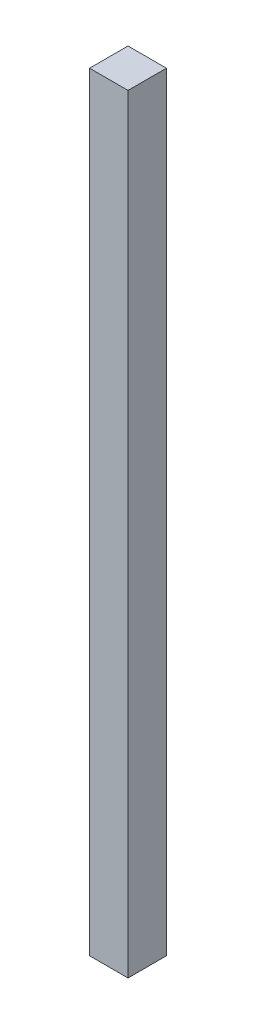
from build123d import *

# Parameters (mm, degrees)
SKIZZE2_W                       = 20
SKIZZE2_H                       = 20
AUFSATZ_LINEAR_AUSTRAGEN1_DEPTH = 400


with BuildPart() as part:
    # Skizze2 → Aufsatz-Linear austragen1 (new body)
    with BuildSketch(Plane(origin=(0, 0, 0), x_dir=(1, 0, 0), z_dir=(0, 1, 0))):
        Rectangle(SKIZZE2_W, SKIZZE2_H)
    extrude(amount=AUFSATZ_LINEAR_AUSTRAGEN1_DEPTH)


solid = part.part
